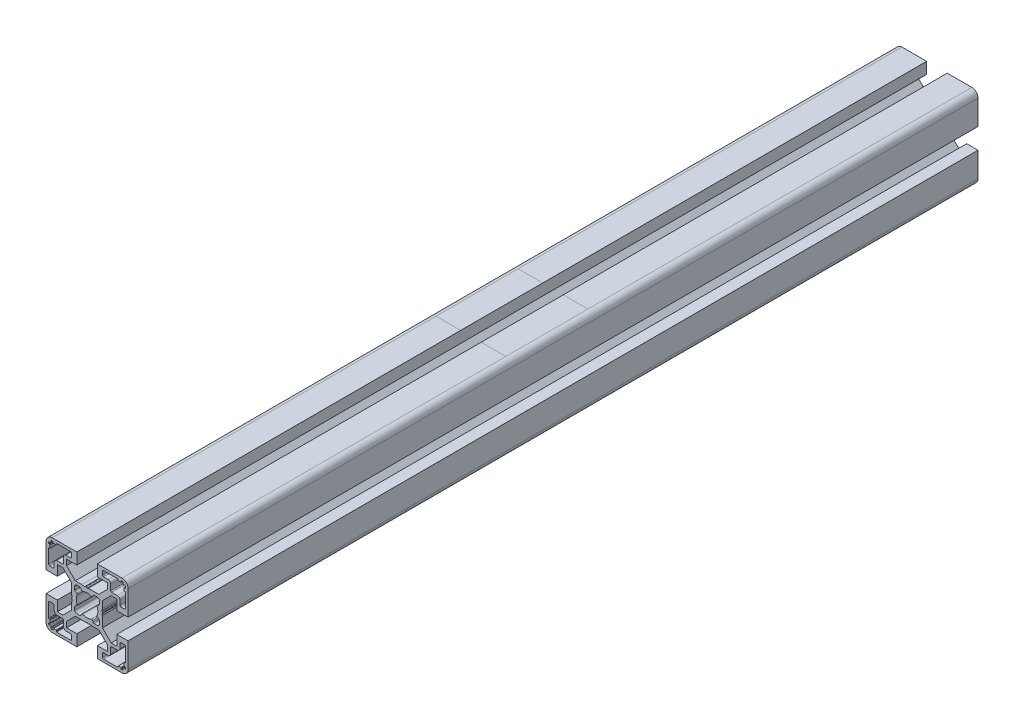
from build123d import *

# Parameters (mm, degrees)
BOSS_EXTRU_1_DEPTH = 414


with BuildPart() as part:
    # Esquisse1 → Boss.-Extru.1 (new body)
    with BuildSketch(Plane.XY.offset(50)):
        with BuildLine():
            Line((-12.564461466, 27.123082583), (-12.564461466, 15.123082583))
            Line((-12.564461466, 15.123082583), (-7.064461466, 15.123082583))
            Line((-7.064461466, 15.123082583), (-7.064461466, 20.123082583))
            Line((-7.064461466, 20.123082583), (-4.332228419, 20.123082583))
            Line((-4.332228419, 20.123082583), (-0.064461466, 15.85531563))
            Line((-0.064461466, 15.85531563), (-0.064461466, 10.776672421))
            ThreePointArc((-0.064461466, 10.776672421), (-0.047424379, 10.647262899), (0.002525832, 10.526672421))
            Line((0.002525832, 10.526672421), (0.235538534, 10.123082583))
            Line((0.235538534, 10.123082583), (0.002525832, 9.719492744))
            ThreePointArc((0.002525832, 9.719492744), (-0.064461466, 9.469492744), (0.002525832, 9.219492744))
            Line((0.002525832, 9.219492744), (0.184561942, 8.904196954))
            Line((0.184561942, 8.904196954), (-0.064461466, 7.623082583))
            Line((-0.064461466, 7.623082583), (-0.064461466, 4.390849536))
            Line((-0.064461466, 4.390849536), (-4.332228419, 0.123082583))
            Line((-4.332228419, 0.123082583), (-7.064461466, 0.123082583))
            Line((-7.064461466, 0.123082583), (-7.064461466, 5.123082583))
            Line((-7.064461466, 5.123082583), (-12.564461466, 5.123082583))
            Line((-12.564461466, 5.123082583), (-12.564461466, -6.876917417))
            ThreePointArc((-12.564461466, -6.876917417), (-11.685781809, -8.998237761), (-9.564461466, -9.876917417))
            Line((-9.564461466, -9.876917417), (2.435538534, -9.876917417))
            Line((2.435538534, -9.876917417), (2.435538534, -4.376917417))
            Line((2.435538534, -4.376917417), (-2.564461466, -4.376917417))
            Line((-2.564461466, -4.376917417), (-2.564461466, -1.64468437))
            Line((-2.564461466, -1.64468437), (1.703305487, 2.623082583))
            Line((1.703305487, 2.623082583), (6.781948696, 2.623082583))
            ThreePointArc((6.781948696, 2.623082583), (6.911358218, 2.640119669), (7.031948696, 2.690069881))
            Line((7.031948696, 2.690069881), (7.435538534, 2.923082583))
            Line((7.435538534, 2.923082583), (7.839128373, 2.690069881))
            ThreePointArc((7.839128373, 2.690069881), (8.089128373, 2.623082583), (8.339128373, 2.690069881))
            Line((8.339128373, 2.690069881), (8.654424163, 2.87210599))
            Line((8.654424163, 2.87210599), (9.935538534, 2.623082583))
            Line((9.935538534, 2.623082583), (13.167771581, 2.623082583))
            Line((13.167771581, 2.623082583), (17.435538534, -1.64468437))
            Line((17.435538534, -1.64468437), (17.435538534, -4.376917417))
            Line((17.435538534, -4.376917417), (12.435538534, -4.376917417))
            Line((12.435538534, -4.376917417), (12.435538534, -9.876917417))
            Line((12.435538534, -9.876917417), (24.435538534, -9.876917417))
            ThreePointArc((24.435538534, -9.876917417), (26.556858878, -8.998237761), (27.435538534, -6.876917417))
            Line((27.435538534, -6.876917417), (27.435538534, 5.123082583))
            Line((27.435538534, 5.123082583), (21.935538534, 5.123082583))
            Line((21.935538534, 5.123082583), (21.935538534, 0.123082583))
            Line((21.935538534, 0.123082583), (19.203305487, 0.123082583))
            Line((19.203305487, 0.123082583), (14.935538534, 4.390849536))
            Line((14.935538534, 4.390849536), (14.935538534, 9.469492744))
            ThreePointArc((14.935538534, 9.469492744), (14.918501447, 9.598902267), (14.868551236, 9.719492744))
            Line((14.868551236, 9.719492744), (14.635538534, 10.123082583))
            Line((14.635538534, 10.123082583), (14.868551236, 10.526672421))
            ThreePointArc((14.868551236, 10.526672421), (14.935538534, 10.776672421), (14.868551236, 11.026672421))
            Line((14.868551236, 11.026672421), (14.686515127, 11.341968211))
            Line((14.686515127, 11.341968211), (14.935538534, 12.623082583))
            Line((14.935538534, 12.623082583), (14.935538534, 15.85531563))
            Line((14.935538534, 15.85531563), (19.203305487, 20.123082583))
            Line((19.203305487, 20.123082583), (21.935538534, 20.123082583))
            Line((21.935538534, 20.123082583), (21.935538534, 15.123082583))
            Line((21.935538534, 15.123082583), (27.435538534, 15.123082583))
            Line((27.435538534, 15.123082583), (27.435538534, 27.123082583))
            ThreePointArc((27.435538534, 27.123082583), (26.556858878, 29.244402926), (24.435538534, 30.123082583))
            Line((24.435538534, 30.123082583), (12.435538534, 30.123082583))
            Line((12.435538534, 30.123082583), (12.435538534, 24.623082583))
            Line((12.435538534, 24.623082583), (17.435538534, 24.623082583))
            Line((17.435538534, 24.623082583), (17.435538534, 21.890849536))
            Line((17.435538534, 21.890849536), (13.167771581, 17.623082583))
            Line((13.167771581, 17.623082583), (8.089128373, 17.623082583))
            ThreePointArc((8.089128373, 17.623082583), (7.95971885, 17.606045496), (7.839128373, 17.556095285))
            Line((7.839128373, 17.556095285), (7.435538534, 17.323082583))
            Line((7.435538534, 17.323082583), (7.031948696, 17.556095285))
            ThreePointArc((7.031948696, 17.556095285), (6.781948696, 17.623082583), (6.531948696, 17.556095285))
            Line((6.531948696, 17.556095285), (6.216652905, 17.374059175))
            Line((6.216652905, 17.374059175), (4.935538534, 17.623082583))
            Line((4.935538534, 17.623082583), (1.703305487, 17.623082583))
            Line((1.703305487, 17.623082583), (-2.564461466, 21.890849536))
            Line((-2.564461466, 21.890849536), (-2.564461466, 24.623082583))
            Line((-2.564461466, 24.623082583), (2.435538534, 24.623082583))
            Line((2.435538534, 24.623082583), (2.435538534, 30.123082583))
            Line((2.435538534, 30.123082583), (-9.564461466, 30.123082583))
            ThreePointArc((-9.564461466, 30.123082583), (-11.685781809, 29.244402926), (-12.564461466, 27.123082583))
        make_face()
        with BuildLine():
            Line((-11.264461466, -4.676917417), (-11.264461466, 2.123082583))
            ThreePointArc((-11.264461466, 2.123082583), (-11.118014856, 2.476635973), (-10.764461466, 2.623082583))
            Line((-10.764461466, 2.623082583), (-9.064461466, 2.623082583))
            ThreePointArc((-9.064461466, 2.623082583), (-8.710908075, 2.476635973), (-8.564461466, 2.123082583))
            Line((-8.564461466, 2.123082583), (-8.564461466, -0.076917417))
            ThreePointArc((-8.564461466, -0.076917417), (-8.183700281, -0.996156233), (-7.264461466, -1.376917417))
            Line((-7.264461466, -1.376917417), (-4.564461466, -1.376917417))
            ThreePointArc((-4.564461466, -1.376917417), (-4.210908075, -1.523364027), (-4.064461466, -1.876917417))
            Line((-4.064461466, -1.876917417), (-4.064461466, -4.576917417))
            ThreePointArc((-4.064461466, -4.576917417), (-3.683700281, -5.496156233), (-2.764461466, -5.876917417))
            Line((-2.764461466, -5.876917417), (-0.564461466, -5.876917417))
            ThreePointArc((-0.564461466, -5.876917417), (-0.210908075, -6.023364027), (-0.064461466, -6.376917417))
            Line((-0.064461466, -6.376917417), (-0.064461466, -8.076917417))
            ThreePointArc((-0.064461466, -8.076917417), (-0.210908075, -8.430470808), (-0.564461466, -8.576917417))
            Line((-0.564461466, -8.576917417), (-7.364461466, -8.576917417))
            ThreePointArc((-7.364461466, -8.576917417), (-7.505882822, -8.518338774), (-7.564461466, -8.376917417))
            Line((-7.564461466, -8.376917417), (-7.564461466, -8.076917417))
            ThreePointArc((-7.564461466, -8.076917417), (-7.62304011, -7.935496061), (-7.764461466, -7.876917417))
            Line((-7.764461466, -7.876917417), (-8.964461466, -7.876917417))
            ThreePointArc((-8.964461466, -7.876917417), (-9.105882822, -7.935496061), (-9.164461466, -8.076917417))
            Line((-9.164461466, -8.076917417), (-9.164461466, -8.376917417))
            ThreePointArc((-9.164461466, -8.376917417), (-9.22304011, -8.518338774), (-9.364461466, -8.576917417))
            Line((-9.364461466, -8.576917417), (-9.864461466, -8.576917417))
            ThreePointArc((-9.864461466, -8.576917417), (-10.0765935, -8.489049452), (-10.164461466, -8.276917417))
            Line((-10.164461466, -8.276917417), (-10.164461466, -7.776917417))
            ThreePointArc((-10.164461466, -7.776917417), (-10.252329431, -7.564785383), (-10.464461466, -7.476917417))
            Line((-10.464461466, -7.476917417), (-10.964461466, -7.476917417))
            ThreePointArc((-10.964461466, -7.476917417), (-11.1765935, -7.389049452), (-11.264461466, -7.176917417))
            Line((-11.264461466, -7.176917417), (-11.264461466, -6.676917417))
            ThreePointArc((-11.264461466, -6.676917417), (-11.205882822, -6.535496061), (-11.064461466, -6.476917417))
            Line((-11.064461466, -6.476917417), (-10.764461466, -6.476917417))
            ThreePointArc((-10.764461466, -6.476917417), (-10.62304011, -6.418338774), (-10.564461466, -6.276917417))
            Line((-10.564461466, -6.276917417), (-10.564461466, -5.076917417))
            ThreePointArc((-10.564461466, -5.076917417), (-10.62304011, -4.935496061), (-10.764461466, -4.876917417))
            Line((-10.764461466, -4.876917417), (-11.064461466, -4.876917417))
            ThreePointArc((-11.064461466, -4.876917417), (-11.205882822, -4.818338774), (-11.264461466, -4.676917417))
        make_face(mode=Mode.SUBTRACT)
        with BuildLine():
            Line((14.935538534, -8.076917417), (14.935538534, -6.376917417))
            ThreePointArc((14.935538534, -6.376917417), (15.081985144, -6.023364027), (15.435538534, -5.876917417))
            Line((15.435538534, -5.876917417), (17.635538534, -5.876917417))
            ThreePointArc((17.635538534, -5.876917417), (18.55477735, -5.496156233), (18.935538534, -4.576917417))
            Line((18.935538534, -4.576917417), (18.935538534, -1.876917417))
            ThreePointArc((18.935538534, -1.876917417), (19.081985144, -1.523364027), (19.435538534, -1.376917417))
            Line((19.435538534, -1.376917417), (22.135538534, -1.376917417))
            ThreePointArc((22.135538534, -1.376917417), (23.05477735, -0.996156233), (23.435538534, -0.076917417))
            Line((23.435538534, -0.076917417), (23.435538534, 2.123082583))
            ThreePointArc((23.435538534, 2.123082583), (23.581985144, 2.476635973), (23.935538534, 2.623082583))
            Line((23.935538534, 2.623082583), (25.635538534, 2.623082583))
            ThreePointArc((25.635538534, 2.623082583), (25.989091925, 2.476635973), (26.135538534, 2.123082583))
            Line((26.135538534, 2.123082583), (26.135538534, -4.676917417))
            ThreePointArc((26.135538534, -4.676917417), (26.07695989, -4.818338774), (25.935538534, -4.876917417))
            Line((25.935538534, -4.876917417), (25.635538534, -4.876917417))
            ThreePointArc((25.635538534, -4.876917417), (25.494117178, -4.935496061), (25.435538534, -5.076917417))
            Line((25.435538534, -5.076917417), (25.435538534, -6.276917417))
            ThreePointArc((25.435538534, -6.276917417), (25.494117178, -6.418338774), (25.635538534, -6.476917417))
            Line((25.635538534, -6.476917417), (25.935538534, -6.476917417))
            ThreePointArc((25.935538534, -6.476917417), (26.07695989, -6.535496061), (26.135538534, -6.676917417))
            Line((26.135538534, -6.676917417), (26.135538534, -7.176917417))
            ThreePointArc((26.135538534, -7.176917417), (26.047670569, -7.389049452), (25.835538534, -7.476917417))
            Line((25.835538534, -7.476917417), (25.335538534, -7.476917417))
            ThreePointArc((25.335538534, -7.476917417), (25.1234065, -7.564785383), (25.035538534, -7.776917417))
            Line((25.035538534, -7.776917417), (25.035538534, -8.276917417))
            ThreePointArc((25.035538534, -8.276917417), (24.947670569, -8.489049452), (24.735538534, -8.576917417))
            Line((24.735538534, -8.576917417), (24.235538534, -8.576917417))
            ThreePointArc((24.235538534, -8.576917417), (24.094117178, -8.518338774), (24.035538534, -8.376917417))
            Line((24.035538534, -8.376917417), (24.035538534, -8.076917417))
            ThreePointArc((24.035538534, -8.076917417), (23.97695989, -7.935496061), (23.835538534, -7.876917417))
            Line((23.835538534, -7.876917417), (22.635538534, -7.876917417))
            ThreePointArc((22.635538534, -7.876917417), (22.494117178, -7.935496061), (22.435538534, -8.076917417))
            Line((22.435538534, -8.076917417), (22.435538534, -8.376917417))
            ThreePointArc((22.435538534, -8.376917417), (22.37695989, -8.518338774), (22.235538534, -8.576917417))
            Line((22.235538534, -8.576917417), (15.435538534, -8.576917417))
            ThreePointArc((15.435538534, -8.576917417), (15.081985144, -8.430470808), (14.935538534, -8.076917417))
        make_face(mode=Mode.SUBTRACT)
        with BuildLine():
            Line((14.935538534, 26.623082583), (14.935538534, 28.323082583))
            ThreePointArc((14.935538534, 28.323082583), (15.081985144, 28.676635973), (15.435538534, 28.823082583))
            Line((15.435538534, 28.823082583), (22.235538534, 28.823082583))
            ThreePointArc((22.235538534, 28.823082583), (22.37695989, 28.764503939), (22.435538534, 28.623082583))
            Line((22.435538534, 28.623082583), (22.435538534, 28.323082583))
            ThreePointArc((22.435538534, 28.323082583), (22.494117178, 28.181661226), (22.635538534, 28.123082583))
            Line((22.635538534, 28.123082583), (23.835538534, 28.123082583))
            ThreePointArc((23.835538534, 28.123082583), (23.97695989, 28.181661226), (24.035538534, 28.323082583))
            Line((24.035538534, 28.323082583), (24.035538534, 28.623082583))
            ThreePointArc((24.035538534, 28.623082583), (24.094117178, 28.764503939), (24.235538534, 28.823082583))
            Line((24.235538534, 28.823082583), (24.735538534, 28.823082583))
            ThreePointArc((24.735538534, 28.823082583), (24.947670569, 28.735214617), (25.035538534, 28.523082583))
            Line((25.035538534, 28.523082583), (25.035538534, 28.023082583))
            ThreePointArc((25.035538534, 28.023082583), (25.1234065, 27.810950548), (25.335538534, 27.723082583))
            Line((25.335538534, 27.723082583), (25.835538534, 27.723082583))
            ThreePointArc((25.835538534, 27.723082583), (26.047670569, 27.635214617), (26.135538534, 27.423082583))
            Line((26.135538534, 27.423082583), (26.135538534, 26.923082583))
            ThreePointArc((26.135538534, 26.923082583), (26.07695989, 26.781661226), (25.935538534, 26.723082583))
            Line((25.935538534, 26.723082583), (25.635538534, 26.723082583))
            ThreePointArc((25.635538534, 26.723082583), (25.494117178, 26.664503939), (25.435538534, 26.523082583))
            Line((25.435538534, 26.523082583), (25.435538534, 25.323082583))
            ThreePointArc((25.435538534, 25.323082583), (25.494117178, 25.181661226), (25.635538534, 25.123082583))
            Line((25.635538534, 25.123082583), (25.935538534, 25.123082583))
            ThreePointArc((25.935538534, 25.123082583), (26.07695989, 25.064503939), (26.135538534, 24.923082583))
            Line((26.135538534, 24.923082583), (26.135538534, 18.123082583))
            ThreePointArc((26.135538534, 18.123082583), (25.989091925, 17.769529192), (25.635538534, 17.623082583))
            Line((25.635538534, 17.623082583), (23.935538534, 17.623082583))
            ThreePointArc((23.935538534, 17.623082583), (23.581985144, 17.769529192), (23.435538534, 18.123082583))
            Line((23.435538534, 18.123082583), (23.435538534, 20.323082583))
            ThreePointArc((23.435538534, 20.323082583), (23.05477735, 21.242321398), (22.135538534, 21.623082583))
            Line((22.135538534, 21.623082583), (19.435538534, 21.623082583))
            ThreePointArc((19.435538534, 21.623082583), (19.081985144, 21.769529192), (18.935538534, 22.123082583))
            Line((18.935538534, 22.123082583), (18.935538534, 24.823082583))
            ThreePointArc((18.935538534, 24.823082583), (18.55477735, 25.742321398), (17.635538534, 26.123082583))
            Line((17.635538534, 26.123082583), (15.435538534, 26.123082583))
            ThreePointArc((15.435538534, 26.123082583), (15.081985144, 26.269529192), (14.935538534, 26.623082583))
        make_face(mode=Mode.SUBTRACT)
        with BuildLine():
            Line((-11.264461466, 18.123082583), (-11.264461466, 24.923082583))
            ThreePointArc((-11.264461466, 24.923082583), (-11.205882822, 25.064503939), (-11.064461466, 25.123082583))
            Line((-11.064461466, 25.123082583), (-10.764461466, 25.123082583))
            ThreePointArc((-10.764461466, 25.123082583), (-10.62304011, 25.181661226), (-10.564461466, 25.323082583))
            Line((-10.564461466, 25.323082583), (-10.564461466, 26.523082583))
            ThreePointArc((-10.564461466, 26.523082583), (-10.62304011, 26.664503939), (-10.764461466, 26.723082583))
            Line((-10.764461466, 26.723082583), (-11.064461466, 26.723082583))
            ThreePointArc((-11.064461466, 26.723082583), (-11.205882822, 26.781661226), (-11.264461466, 26.923082583))
            Line((-11.264461466, 26.923082583), (-11.264461466, 27.423082583))
            ThreePointArc((-11.264461466, 27.423082583), (-11.1765935, 27.635214617), (-10.964461466, 27.723082583))
            Line((-10.964461466, 27.723082583), (-10.464461466, 27.723082583))
            ThreePointArc((-10.464461466, 27.723082583), (-10.252329431, 27.810950548), (-10.164461466, 28.023082583))
            Line((-10.164461466, 28.023082583), (-10.164461466, 28.523082583))
            ThreePointArc((-10.164461466, 28.523082583), (-10.0765935, 28.735214617), (-9.864461466, 28.823082583))
            Line((-9.864461466, 28.823082583), (-9.364461466, 28.823082583))
            ThreePointArc((-9.364461466, 28.823082583), (-9.22304011, 28.764503939), (-9.164461466, 28.623082583))
            Line((-9.164461466, 28.623082583), (-9.164461466, 28.323082583))
            ThreePointArc((-9.164461466, 28.323082583), (-9.105882822, 28.181661226), (-8.964461466, 28.123082583))
            Line((-8.964461466, 28.123082583), (-7.764461466, 28.123082583))
            ThreePointArc((-7.764461466, 28.123082583), (-7.62304011, 28.181661226), (-7.564461466, 28.323082583))
            Line((-7.564461466, 28.323082583), (-7.564461466, 28.623082583))
            ThreePointArc((-7.564461466, 28.623082583), (-7.505882822, 28.764503939), (-7.364461466, 28.823082583))
            Line((-7.364461466, 28.823082583), (-0.564461466, 28.823082583))
            ThreePointArc((-0.564461466, 28.823082583), (-0.210908075, 28.676635973), (-0.064461466, 28.323082583))
            Line((-0.064461466, 28.323082583), (-0.064461466, 26.623082583))
            ThreePointArc((-0.064461466, 26.623082583), (-0.210908075, 26.269529192), (-0.564461466, 26.123082583))
            Line((-0.564461466, 26.123082583), (-2.764461466, 26.123082583))
            ThreePointArc((-2.764461466, 26.123082583), (-3.683700281, 25.742321398), (-4.064461466, 24.823082583))
            Line((-4.064461466, 24.823082583), (-4.064461466, 22.123082583))
            ThreePointArc((-4.064461466, 22.123082583), (-4.210908075, 21.769529192), (-4.564461466, 21.623082583))
            Line((-4.564461466, 21.623082583), (-7.264461466, 21.623082583))
            ThreePointArc((-7.264461466, 21.623082583), (-8.183700281, 21.242321398), (-8.564461466, 20.323082583))
            Line((-8.564461466, 20.323082583), (-8.564461466, 18.123082583))
            ThreePointArc((-8.564461466, 18.123082583), (-8.710908075, 17.769529192), (-9.064461466, 17.623082583))
            Line((-9.064461466, 17.623082583), (-10.764461466, 17.623082583))
            ThreePointArc((-10.764461466, 17.623082583), (-11.118014856, 17.769529192), (-11.264461466, 18.123082583))
        make_face(mode=Mode.SUBTRACT)
        with BuildLine():
            Line((10.926225434, 16.123082583), (12.435538534, 16.123082583))
            ThreePointArc((12.435538534, 16.123082583), (13.142645315, 15.830189364), (13.435538534, 15.123082583))
            Line((13.435538534, 15.123082583), (13.435538534, 13.613769482))
            ThreePointArc((13.435538534, 13.613769482), (13.364122185, 13.356250445), (13.170274316, 13.172295686))
            Line((13.170274316, 13.172295686), (12.493256258, 12.812318799))
            ThreePointArc((12.493256258, 12.812318799), (12.256654607, 12.537701304), (12.267778691, 12.175387401))
            ThreePointArc((12.267778691, 12.175387401), (12.685538534, 10.123082583), (12.267778691, 8.070777764))
            ThreePointArc((12.267778691, 8.070777764), (12.256654607, 7.708463861), (12.493256258, 7.433846366))
            Line((12.493256258, 7.433846366), (13.170274316, 7.07386948))
            ThreePointArc((13.170274316, 7.07386948), (13.364122185, 6.889914721), (13.435538534, 6.632395683))
            Line((13.435538534, 6.632395683), (13.435538534, 5.123082583))
            ThreePointArc((13.435538534, 5.123082583), (13.142645315, 4.415975801), (12.435538534, 4.123082583))
            Line((12.435538534, 4.123082583), (10.926225434, 4.123082583))
            ThreePointArc((10.926225434, 4.123082583), (10.668706396, 4.194498932), (10.484751637, 4.388346801))
            Line((10.484751637, 4.388346801), (10.124774751, 5.065364859))
            ThreePointArc((10.124774751, 5.065364859), (9.850157255, 5.301966509), (9.487843352, 5.290842426))
            ThreePointArc((9.487843352, 5.290842426), (7.435538534, 4.873082583), (5.383233716, 5.290842426))
            ThreePointArc((5.383233716, 5.290842426), (5.020919813, 5.301966509), (4.746302318, 5.065364859))
            Line((4.746302318, 5.065364859), (4.386325431, 4.388346801))
            ThreePointArc((4.386325431, 4.388346801), (4.202370672, 4.194498932), (3.944851635, 4.123082583))
            Line((3.944851635, 4.123082583), (2.435538534, 4.123082583))
            ThreePointArc((2.435538534, 4.123082583), (1.728431753, 4.415975801), (1.435538534, 5.123082583))
            Line((1.435538534, 5.123082583), (1.435538534, 6.632395683))
            ThreePointArc((1.435538534, 6.632395683), (1.506954884, 6.889914721), (1.700802753, 7.07386948))
            Line((1.700802753, 7.07386948), (2.37782081, 7.433846366))
            ThreePointArc((2.37782081, 7.433846366), (2.614422461, 7.708463861), (2.603298377, 8.070777764))
            ThreePointArc((2.603298377, 8.070777764), (2.185538534, 10.123082583), (2.603298377, 12.175387401))
            ThreePointArc((2.603298377, 12.175387401), (2.614422461, 12.537701304), (2.37782081, 12.812318799))
            Line((2.37782081, 12.812318799), (1.700802753, 13.172295686))
            ThreePointArc((1.700802753, 13.172295686), (1.506954884, 13.356250445), (1.435538534, 13.613769482))
            Line((1.435538534, 13.613769482), (1.435538534, 15.123082583))
            ThreePointArc((1.435538534, 15.123082583), (1.728431753, 15.830189364), (2.435538534, 16.123082583))
            Line((2.435538534, 16.123082583), (3.944851635, 16.123082583))
            ThreePointArc((3.944851635, 16.123082583), (4.202370672, 16.051666233), (4.386325431, 15.857818364))
            Line((4.386325431, 15.857818364), (4.746302318, 15.180800306))
            ThreePointArc((4.746302318, 15.180800306), (5.020919813, 14.944198656), (5.383233716, 14.955322739))
            ThreePointArc((5.383233716, 14.955322739), (7.435538534, 15.373082583), (9.487843352, 14.955322739))
            ThreePointArc((9.487843352, 14.955322739), (9.850157255, 14.944198656), (10.124774751, 15.180800306))
            Line((10.124774751, 15.180800306), (10.484751637, 15.857818364))
            ThreePointArc((10.484751637, 15.857818364), (10.668706396, 16.051666233), (10.926225434, 16.123082583))
        make_face(mode=Mode.SUBTRACT)
    extrude(amount=-BOSS_EXTRU_1_DEPTH)


solid = part.part
